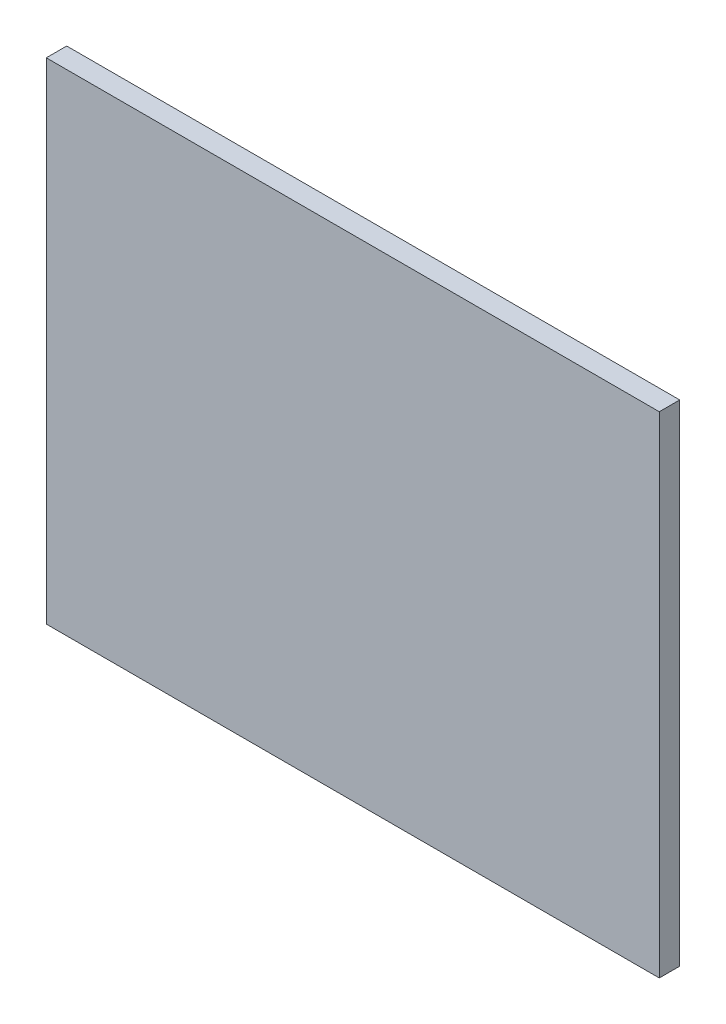
from build123d import *

# Parameters (mm, degrees)
SKETCH1_W           = 1500
SKETCH1_H           = 1200
BOSS_EXTRUDE1_DEPTH = 50


with BuildPart() as part:
    # Sketch1 → Boss-Extrude1 (new body)
    with BuildSketch(Plane.XY):
        Rectangle(SKETCH1_W, SKETCH1_H)
    extrude(amount=BOSS_EXTRUDE1_DEPTH)


solid = part.part
